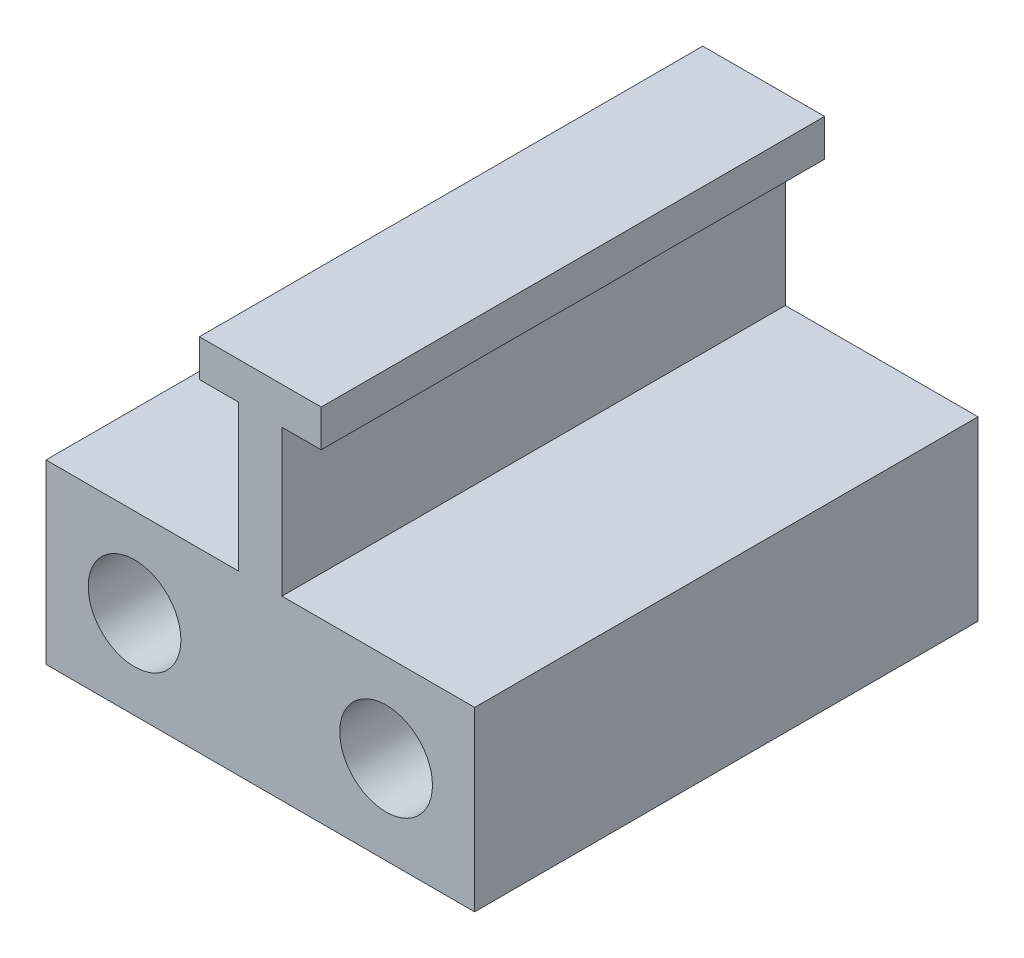
from build123d import *

# Parameters (mm, degrees)
SKETCH1_R           = 7.5
SKETCH1_R_2         = 7.499999997
BOSS_EXTRUDE1_DEPTH = 81.44


with BuildPart() as part:
    # Sketch1 → Boss-Extrude1 (new body)
    with BuildSketch(Plane.XY):
        Polygon((-9.85, 39.223330846), (9.85, 39.223330846), (9.85, 33.223330846), (3.5, 33.223330846), (3.5, 9.549540446), (10.165, 9.549540446), (34.6762132, 9.549540446), (34.6762132, -19.102882354), (-34.6762132, -19.102882354), (-34.6762132, 9.549540446), (-10.165, 9.549540446), (-3.5, 9.549540446), (-3.5, 33.223330846), (-9.85, 33.223330846), align=None)
        with Locations((-20.35, -4.776669154)):
            Circle(SKETCH1_R, mode=Mode.SUBTRACT)
        with Locations((20.35, -4.776669154)):
            Circle(SKETCH1_R_2, mode=Mode.SUBTRACT)
    extrude(amount=BOSS_EXTRUDE1_DEPTH)


solid = part.part
